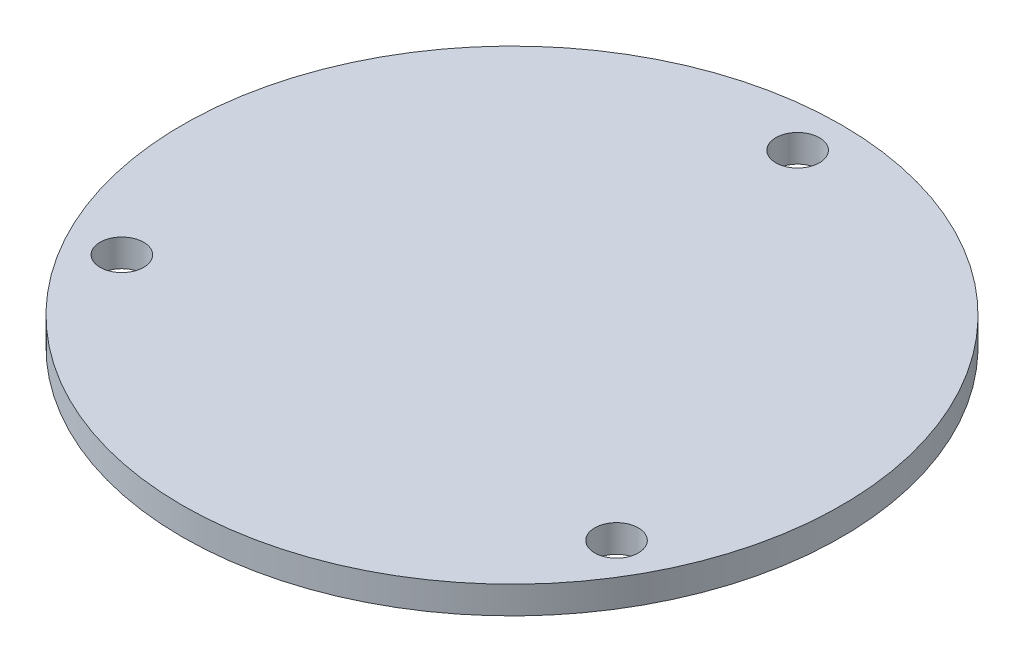
from build123d import *

# Parameters (mm, degrees)
SKETCH1_R           = 19.05
SKETCH1_R_2         = 1.259801651
BOSS_EXTRUDE1_DEPTH = 1.5875


with BuildPart() as part:
    # Sketch1 → Boss-Extrude1 (new body)
    with BuildSketch(Plane(origin=(0, 0, 0), x_dir=(1, 0, 0), z_dir=(0, 1, 0))):
        with Locations(Location((19.05, 19.05, 0), (0, 0, 270))):
            Circle(SKETCH1_R)
        with Locations(Location((19.05, 35.56, 0), (0, 0, 270))):
            Circle(SKETCH1_R_2, mode=Mode.SUBTRACT)
        with Locations(Location((4.751920584, 10.795, 0), (0, 0, 270))):
            Circle(SKETCH1_R_2, mode=Mode.SUBTRACT)
        with Locations(Location((33.348079416, 10.795, 0), (0, 0, 270))):
            Circle(SKETCH1_R_2, mode=Mode.SUBTRACT)
    extrude(amount=BOSS_EXTRUDE1_DEPTH)


solid = part.part
